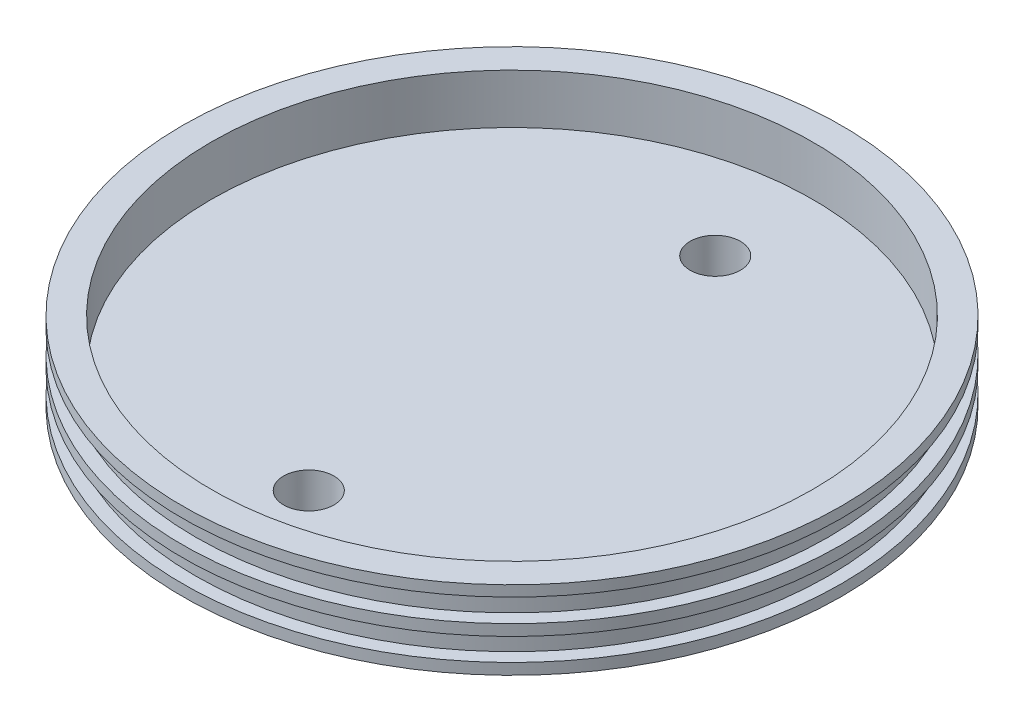
from build123d import *

# Parameters (mm, degrees)
SKETCH6_R                                = 66.04
BOSS_EXTRUDE1_DEPTH                      = 2.54
PIPE_TAP_DRILL_FOR_1_4_TAP_RELIEF_VALV_D = 11.1252
PIPE_TAP_DRILL_FOR_1_4_TAP_VENT_VALVE_D  = 11.1252


with BuildPart() as part:
    # Sketch1 → Revolve1 (revolve)
    with BuildSketch(Plane.XY, mode=Mode.PRIVATE) as revolve1_sk:
        Polygon((0, 0), (72.898, 0), (72.898, 2.4638), (69.977, 2.4638), (69.977, 7.4422), (72.898, 7.4422), (72.898, 9.906), (69.977, 9.906), (69.977, 14.986), (72.898, 14.986), (72.898, 17.3482), (66.548, 17.3482), (66.548, 6.35), (0, 6.35), align=None)
    revolve(revolve1_sk.sketch.rotate(Axis((0, 48.192213231, 0), (0, -1, 0)), 180), axis=Axis((0, 48.192213231, 0), (0, -1, 0)))

    # Sketch6 → Boss-Extrude1 (add)
    with BuildSketch(Plane.XZ):
        Circle(SKETCH6_R)
    extrude(amount=BOSS_EXTRUDE1_DEPTH)

    # Pipe Tap Drill for 1/4 Tap - Relief Valve (through all)
    with Locations(Plane(origin=(0, -2.54, 0), x_dir=(-1, 0, 0), z_dir=(0, -1, 0))):
        with Locations((0, 44.958)):
            Hole(PIPE_TAP_DRILL_FOR_1_4_TAP_RELIEF_VALV_D / 2)

    # Pipe Tap Drill for 1/4 Tap - Vent Valve (through all)
    with Locations(Plane(origin=(0, -2.54, 0), x_dir=(-1, 0, 0), z_dir=(0, -1, 0))):
        with Locations((0, -44.958)):
            Hole(PIPE_TAP_DRILL_FOR_1_4_TAP_VENT_VALVE_D / 2)


solid = part.part
